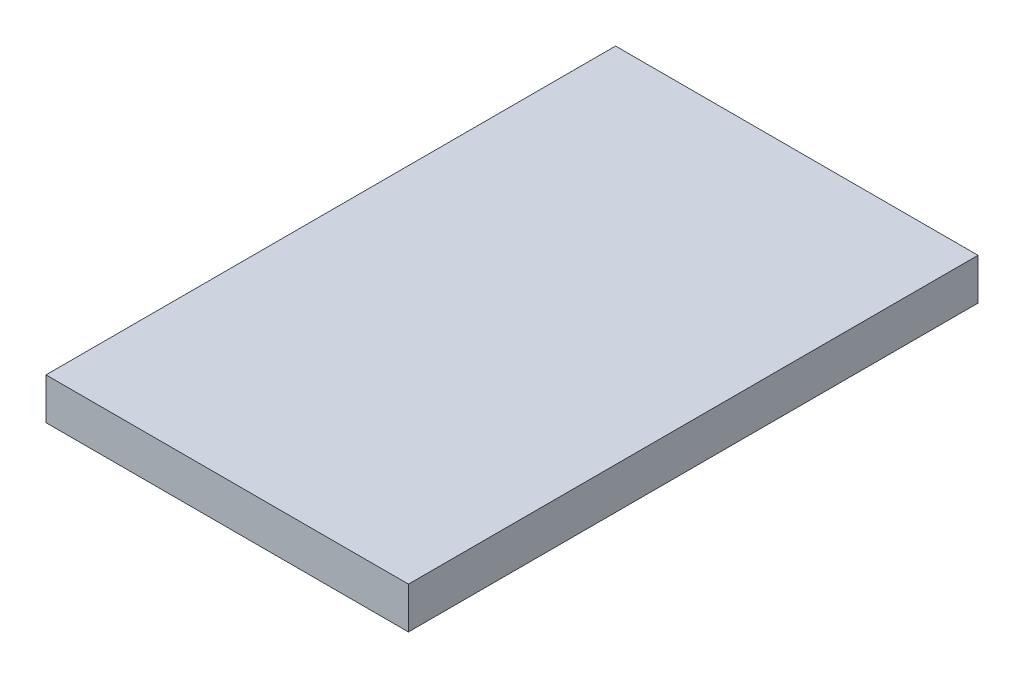
from build123d import *

# Parameters (mm, degrees)
SKETCH1_W           = 35
SKETCH1_H           = 55
BOSS_EXTRUDE1_DEPTH = 4


with BuildPart() as part:
    # Sketch1 → Boss-Extrude1 (new body)
    with BuildSketch(Plane(origin=(0, 0, 0), x_dir=(1, 0, 0), z_dir=(0, 1, 0))):
        with Locations((17.5, -27.5)):
            Rectangle(SKETCH1_W, SKETCH1_H)
    extrude(amount=BOSS_EXTRUDE1_DEPTH)


solid = part.part
